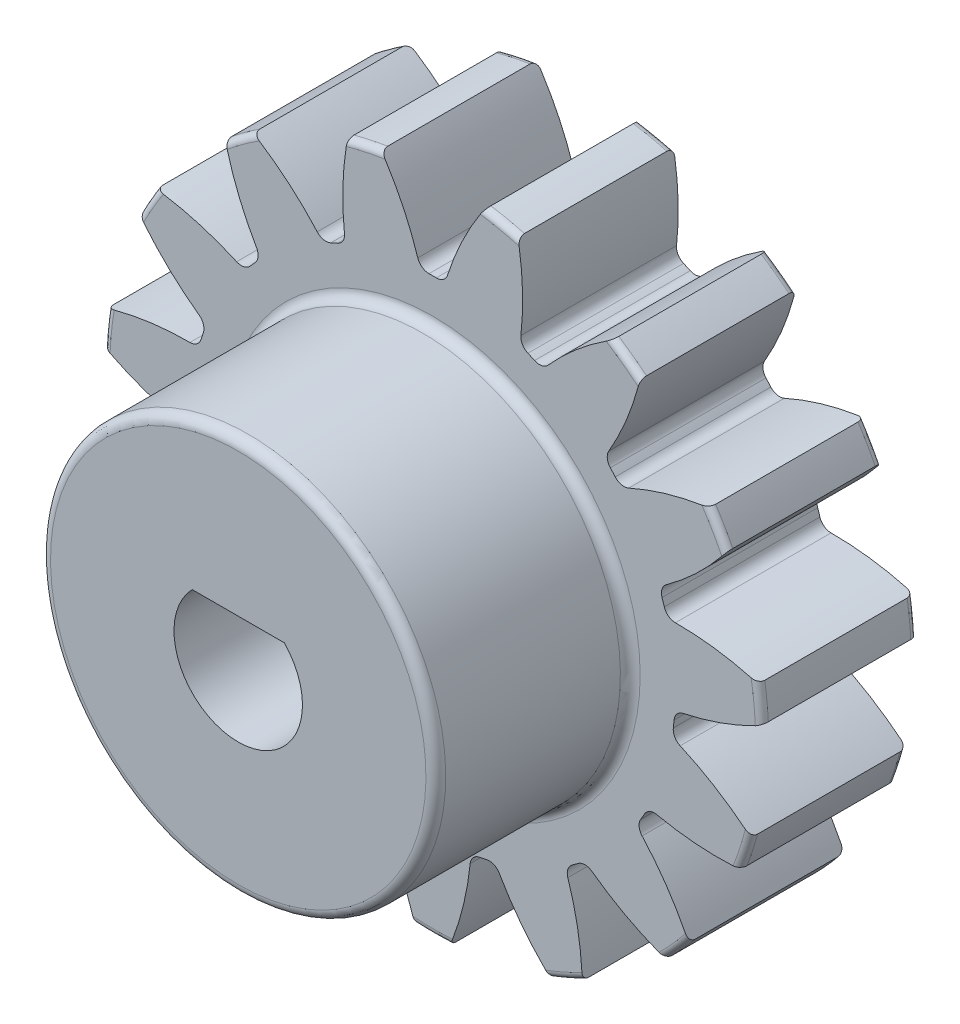
from build123d import *

# Parameters (mm, degrees)
FILLET2_R           = 0.169418
CUT_EXTRUDE2_DEPTH  = 13.980735544
CIRPATTERN1_COUNT   = 15
SKETCH8_R           = 5.08
BOSS_EXTRUDE1_DEPTH = 8.99922
SKETCH9_R           = 11.052215599
SKETCH9_R_2         = 5.08
CUT_EXTRUDE3_DEPTH  = 4.99872
FILLET3_R           = 0.254


with BuildPart() as part:
    # Sketch4 → Revolve1 (revolve)
    with BuildSketch(Plane(origin=(0, 0, 0), x_dir=(0, 0, -1), z_dir=(1, 0, 0))):
        Polygon((-8.99922, 3.96875), (-8.99922, 5.842), (-4.0005, 5.842), (-4.0005, 8.4709), (0, 8.4709), (0, 3.96875), align=None)
    revolve(axis=Axis((0, 0, 4.0005), (0, 0, 1)))

    # Fillet2
    fillet2_edges = [part.edges().sort_by_distance(p)[0] for p in [
        (0, -8.4709, 0),
        (0, -8.4709, 4.0005),
        (0, -5.842, 4.0005),
        (0, -5.842, 8.99922),
    ]]
    fillet(fillet2_edges, radius=FILLET2_R)

    # Sketch7 → Cut-Extrude2 (cut, through all)
    with BuildSketch(Plane.XY.offset(4.0005)):
        with BuildLine():
            ThreePointArc((-0.093804548, 6.229913827), (0, 6.23062), (0.093804548, 6.229913827))
            ThreePointArc((0.093804548, 6.229913827), (0.272465739, 6.285904131), (0.382710699, 6.43723418))
            ThreePointArc((0.382710699, 6.43723418), (0.785077734, 7.435905443), (1.326876769, 8.366334015))
            ThreePointArc((1.326876769, 8.366334015), (0, 8.4709), (-1.326876769, 8.366334015))
            ThreePointArc((-1.326876769, 8.366334015), (-0.785077734, 7.435905443), (-0.382710699, 6.43723418))
            ThreePointArc((-0.382710699, 6.43723418), (-0.272465739, 6.285904131), (-0.093804548, 6.229913827))
        make_face()
    cut_extrude2 = extrude(amount=-CUT_EXTRUDE2_DEPTH, mode=Mode.SUBTRACT)

    # CirPattern1: Cut-Extrude2 ×15 about axis
    cirpattern1_axis = Axis((0, 0, 0), (0, 0, 1))
    for i in range(1, CIRPATTERN1_COUNT):
        add(cut_extrude2.rotate(cirpattern1_axis, i * 360 / CIRPATTERN1_COUNT), mode=Mode.SUBTRACT)

    # Sketch8 → Boss-Extrude1 (add)
    with BuildSketch(Plane.XY.offset(8.99922)):
        Circle(SKETCH8_R)
        with BuildLine():
            Line((-1.183638458, 1.151), (1.183638458, 1.151))
            ThreePointArc((1.183638458, 1.151), (0, -1.651), (-1.183638458, 1.151))
        make_face(mode=Mode.SUBTRACT)
    extrude(amount=-BOSS_EXTRUDE1_DEPTH)

    # Sketch9 → Cut-Extrude3 (cut)
    with BuildSketch(Plane.XY.offset(8.99922)):
        Circle(SKETCH9_R)
        Circle(SKETCH9_R_2, mode=Mode.SUBTRACT)
    extrude(amount=-CUT_EXTRUDE3_DEPTH, mode=Mode.SUBTRACT)

    # Fillet3
    fillet3_edges = [part.edges().sort_by_distance(p)[0] for p in [
        (-5.08, 0, 4.0005),
        (-5.08, 0, 8.99922),
    ]]
    fillet(fillet3_edges, radius=FILLET3_R)


solid = part.part
